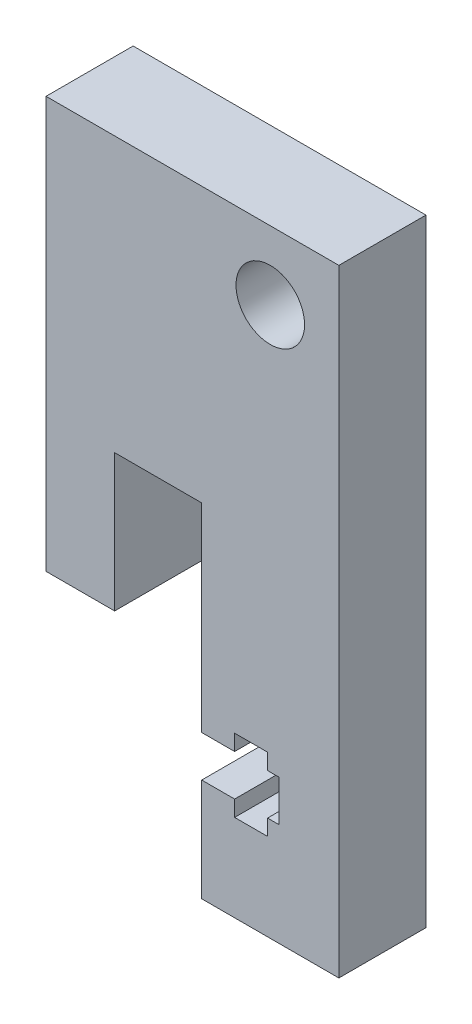
from build123d import *

# Parameters (mm, degrees)
SKETCH1_R           = 2.5
BOSS_EXTRUDE1_DEPTH = 6.35


with BuildPart() as part:
    # Sketch1 → Boss-Extrude1 (new body)
    with BuildSketch(Plane.XY):
        Polygon((8.540553214, -10.783269704), (8.540553214, 34.216730296), (-12.809446786, 34.216730296), (-12.809446786, 4.216730296), (-7.809446786, 4.216730296), (-7.809446786, 14.216730296), (-1.459446786, 14.216730296), (-1.459446786, -0.283269704), (0.940553214, -0.283269704), (0.940553214, 0.876730296), (3.340553214, 0.876730296), (3.340553214, -0.283269704), (4.190553214, -0.283269704), (4.190553214, -3.283269704), (3.340553214, -3.283269704), (3.340553214, -4.443269704), (0.940553214, -4.443269704), (0.940553214, -3.283269704), (-1.459446786, -3.283269704), (-1.459446786, -10.783269704), align=None)
        with Locations((3.540553214, 29.216730296)):
            Circle(SKETCH1_R, mode=Mode.SUBTRACT)
    extrude(amount=BOSS_EXTRUDE1_DEPTH)


solid = part.part
